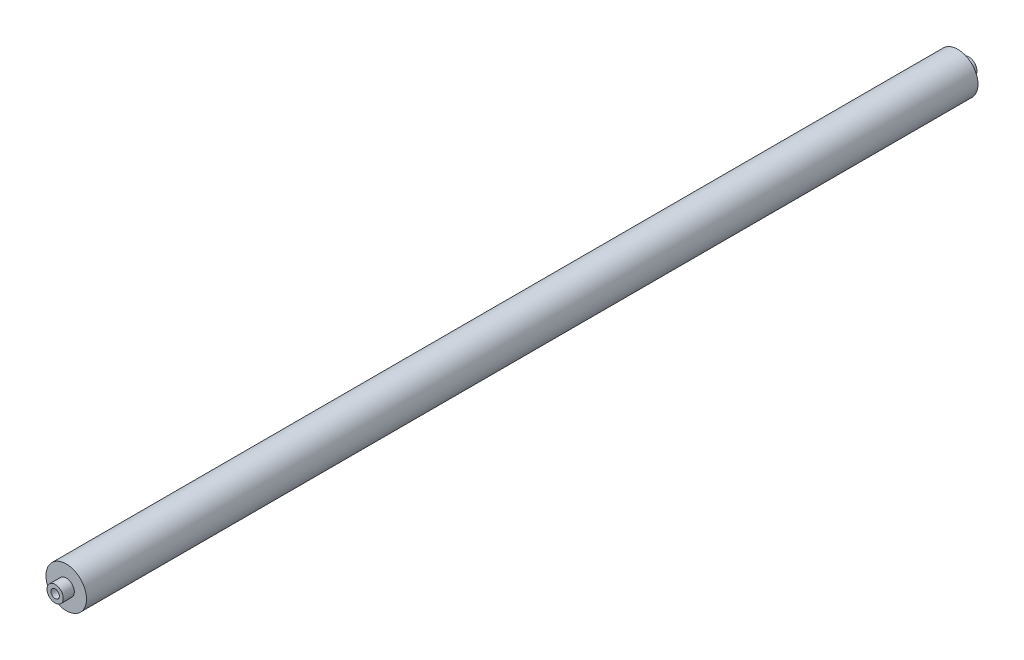
from build123d import *

# Parameters (mm, degrees)
SKETCH1_R                          = 15.875
BOSS_EXTRUDE1_DEPTH                = 698.5
SKETCH2_R                          = 6.35
BOSS_EXTRUDE2_DEPTH                = 12.7
BOSS_EXTRUDE3_START                = 12.7
SKETCH3_R                          = 6.35
BOSS_EXTRUDE3_DEPTH                = 12.7
CBORE_FOR_M6_HEX_HEAD1_D           = 6.6
CBORE_FOR_M6_HEX_HEAD1_DEPTH       = 304.8
CBORE_FOR_M6_HEX_HEAD1_CBORE_D     = 14.547
CBORE_FOR_M6_HEX_HEAD1_CBORE_DEPTH = 4
CBORE_FOR_M6_HEX_HEAD1_TIP         = 1.982840043
CBORE_FOR_M6_HEX_HEAD4_D           = 6.6
CBORE_FOR_M6_HEX_HEAD4_DEPTH       = 304.8
CBORE_FOR_M6_HEX_HEAD4_CBORE_D     = 14.547
CBORE_FOR_M6_HEX_HEAD4_CBORE_DEPTH = 4
CBORE_FOR_M6_HEX_HEAD4_TIP         = 1.982840043


with BuildPart() as part:
    # Sketch1 → Boss-Extrude1 (new body)
    with BuildSketch(Plane.XY):
        Circle(SKETCH1_R)
    extrude(amount=BOSS_EXTRUDE1_DEPTH)

    # Sketch2 → Boss-Extrude2 (add)
    with BuildSketch(Plane.XY.offset(698.5)):
        Circle(SKETCH2_R)
    extrude(amount=BOSS_EXTRUDE2_DEPTH)

    # Sketch3 → Boss-Extrude3 (add)
    with BuildSketch(Plane(origin=(0, 0, 0), x_dir=(-1, 0, 0), z_dir=(0, 0, -1)).offset(BOSS_EXTRUDE3_START)):
        with Locations(Location((0, 0, 0), (0, 0, 180))):
            Circle(SKETCH3_R)
    extrude(amount=-BOSS_EXTRUDE3_DEPTH)

    # CBORE for M6 Hex Head1
    with Locations(Plane.XY.offset(711.2)):
        with Locations((0, 0)):
            CounterBoreHole(CBORE_FOR_M6_HEX_HEAD1_D / 2, CBORE_FOR_M6_HEX_HEAD1_CBORE_D / 2, CBORE_FOR_M6_HEX_HEAD1_CBORE_DEPTH, depth=CBORE_FOR_M6_HEX_HEAD1_DEPTH)
            with Locations((0, 0, -(CBORE_FOR_M6_HEX_HEAD1_DEPTH + CBORE_FOR_M6_HEX_HEAD1_TIP / 2))):  # 118° drill point
                Cone(0, CBORE_FOR_M6_HEX_HEAD1_D / 2, CBORE_FOR_M6_HEX_HEAD1_TIP, mode=Mode.SUBTRACT)

    # CBORE for M6 Hex Head4
    with Locations(Plane(origin=(0, 0, -12.7), x_dir=(-1, 0, 0), z_dir=(0, 0, -1))):
        with Locations((0, 0)):
            CounterBoreHole(CBORE_FOR_M6_HEX_HEAD4_D / 2, CBORE_FOR_M6_HEX_HEAD4_CBORE_D / 2, CBORE_FOR_M6_HEX_HEAD4_CBORE_DEPTH, depth=CBORE_FOR_M6_HEX_HEAD4_DEPTH)
            with Locations((0, 0, -(CBORE_FOR_M6_HEX_HEAD4_DEPTH + CBORE_FOR_M6_HEX_HEAD4_TIP / 2))):  # 118° drill point
                Cone(0, CBORE_FOR_M6_HEX_HEAD4_D / 2, CBORE_FOR_M6_HEX_HEAD4_TIP, mode=Mode.SUBTRACT)


solid = part.part
